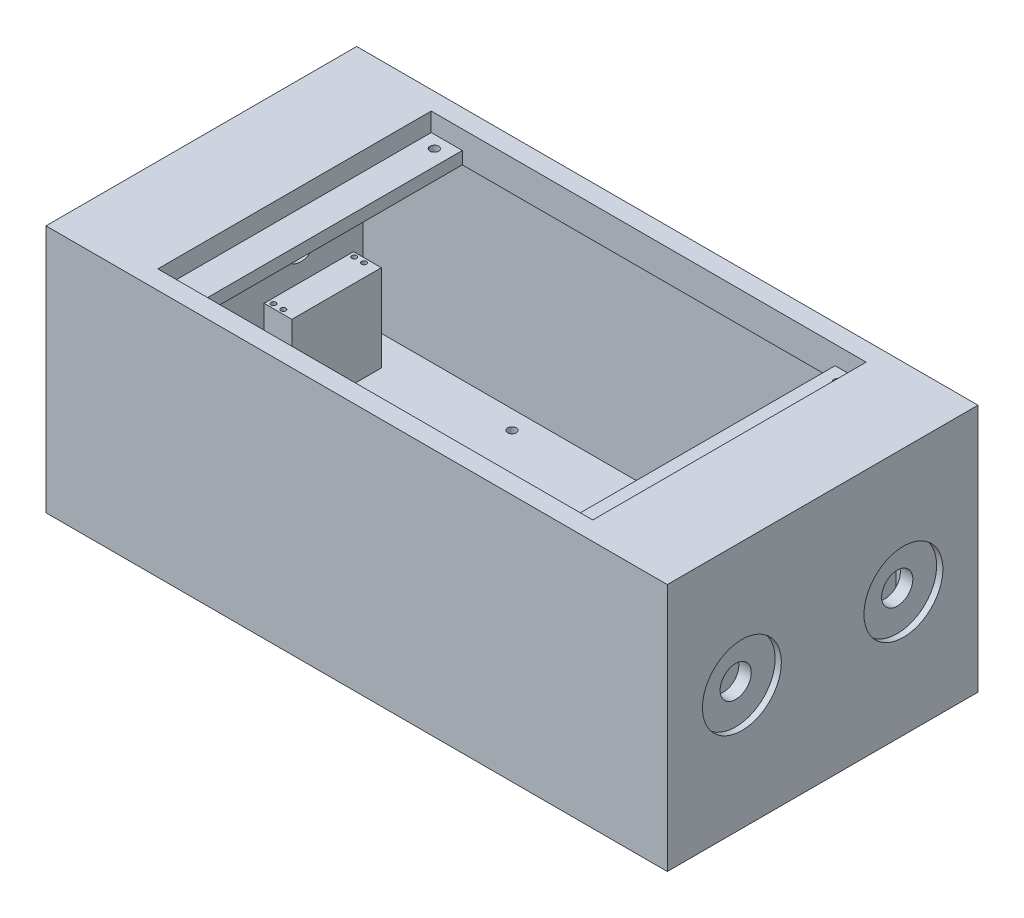
from build123d import *

# Parameters (mm, degrees)
SKETCH1_W                      = 250
SKETCH1_H                      = 200
BOSS_EXTRUDE1_DEPTH            = 250
SKETCH7_W                      = 470
SKETCH7_H                      = 230
CUT_EXTRUDE4_DEPTH             = 80
SKETCH5_R                      = 31.75
F_63_5MM_DIA_SERVO_DEPTH       = 5
MIRROR13_COPY_1_SKETCH_R       = 31.75
MIRROR13_COPY_1_DEPTH          = 5
SKETCH10_W                     = 350
SKETCH10_H                     = 220
CUT_EXTRUDE5_DEPTH             = 20
SKETCH15_W                     = 500
SKETCH15_H                     = 250
BOSS_EXTRUDE2_DEPTH            = 10
SKETCH18_W                     = 300
SKETCH18_H                     = 220
CUT_EXTRUDE11_DEPTH            = 10
SKETCH19_R                     = 3.5
CUT_EXTRUDE12_DEPTH            = 10
MIRROR15_COPY_1_SKETCH_R       = 3.5
MIRROR15_COPY_1_DEPTH          = 10
SKETCH20_R                     = 3.5
CUT_EXTRUDE13_DEPTH            = 10
MIRROR17_COPY_1_SKETCH_R       = 3.5
MIRROR17_COPY_1_DEPTH          = 10
SKETCH22_R                     = 12.55
CUT_EXTRUDE14_DEPTH            = 10
MIRROR19_COPY_1_SKETCH_R       = 12.55
MIRROR19_COPY_1_DEPTH          = 10
SKETCH23_W                     = 22.35
SKETCH23_H                     = 72
BOSS_EXTRUDE3_DEPTH            = 69.9
MIRROR21_COPY_1_SKETCH_W       = 22.35
MIRROR21_COPY_1_SKETCH_H       = 72
MIRROR21_COPY_1_DEPTH          = 69.9
F_1_0MM_DOWEL_HOLE1_AT_2_COUNT = 2
F_1_0MM_DOWEL_HOLE1_AT_2_PITCH = 8
F_1_0MM_DOWEL_HOLE1_AT_3_COUNT = 2
F_1_0MM_DOWEL_HOLE1_AT_3_PITCH = 65.49045732
F_1_0MM_DOWEL_HOLE1_AT_4_COUNT = 2
F_1_0MM_DOWEL_HOLE1_AT_4_PITCH = 65


with BuildPart() as part:
    # Sketch1 → Boss-Extrude1 (new, symmetric)
    with BuildSketch(Plane(origin=(0, 0, 0), x_dir=(0, 0, -1), z_dir=(1, 0, 0))):
        Rectangle(SKETCH1_W, SKETCH1_H)
    extrude(amount=BOSS_EXTRUDE1_DEPTH, both=True)

    # Sketch7 → Cut-Extrude4 (cut, symmetric)
    with BuildSketch(Plane(origin=(0, 0, 0), x_dir=(1, 0, 0), z_dir=(0, 1, 0))):
        Rectangle(SKETCH7_W, SKETCH7_H)
    extrude(amount=CUT_EXTRUDE4_DEPTH, both=True, mode=Mode.SUBTRACT)

    # Sketch5 → 63.5mm_dia_servo (cut)
    with BuildSketch(Plane(origin=(250, 0, 0), x_dir=(0, 0, -1), z_dir=(1, 0, 0))):
        with Locations((-65, 0)):
            Circle(SKETCH5_R)
    f_63_5mm_dia_servo = extrude(amount=-F_63_5MM_DIA_SERVO_DEPTH, mode=Mode.SUBTRACT)

    # Mirror12: 63.5mm_dia_servo across plane
    add(f_63_5mm_dia_servo.mirror(Plane.XY), mode=Mode.SUBTRACT)

    # Mirror13: 63.5mm_dia_servo across plane
    add(f_63_5mm_dia_servo.mirror(Plane(origin=(0, 0, 0), x_dir=(0, 0, 1), z_dir=(1, 0, 0))), mode=Mode.SUBTRACT)

    # Mirror13 copy 1 sketch → Mirror13 copy 1 (cut)
    with BuildSketch(Plane.ZY.offset(250)):
        with Locations((-65, 0)):
            Circle(MIRROR13_COPY_1_SKETCH_R)
    extrude(amount=-MIRROR13_COPY_1_DEPTH, mode=Mode.SUBTRACT)

    # Sketch10 → Cut-Extrude5 (cut)
    with BuildSketch(Plane(origin=(0, 100, 0), x_dir=(1, 0, 0), z_dir=(0, 1, 0))):
        Rectangle(SKETCH10_W, SKETCH10_H)
    extrude(amount=-CUT_EXTRUDE5_DEPTH, mode=Mode.SUBTRACT)

    # Sketch15 → Boss-Extrude2 (add)
    with BuildSketch(Plane(origin=(0, 75, 0), x_dir=(1, 0, 0), z_dir=(0, 1, 0))):
        Rectangle(SKETCH15_W, SKETCH15_H)
    extrude(amount=BOSS_EXTRUDE2_DEPTH)

    # Sketch18 → Cut-Extrude11 (cut)
    with BuildSketch(Plane(origin=(0, 85, 0), x_dir=(1, 0, 0), z_dir=(0, 1, 0))):
        Rectangle(SKETCH18_W, SKETCH18_H)
    extrude(amount=-CUT_EXTRUDE11_DEPTH, mode=Mode.SUBTRACT)

    # Sketch19 → Cut-Extrude12 (cut)
    with BuildSketch(Plane(origin=(0, 85, 0), x_dir=(1, 0, 0), z_dir=(0, 1, 0))):
        with Locations(Location((-162.5, 100, 0), (0, 0, 270))):
            Circle(SKETCH19_R)
    cut_extrude12 = extrude(amount=-CUT_EXTRUDE12_DEPTH, mode=Mode.SUBTRACT)

    # Mirror14: Cut-Extrude12 across plane
    add(cut_extrude12.mirror(Plane.XY), mode=Mode.SUBTRACT)

    # Mirror15: Cut-Extrude12 across plane
    add(cut_extrude12.mirror(Plane(origin=(0, 0, 0), x_dir=(0, 0, 1), z_dir=(1, 0, 0))), mode=Mode.SUBTRACT)

    # Mirror15 copy 1 sketch → Mirror15 copy 1 (cut)
    with BuildSketch(Plane(origin=(0, 85, 0), x_dir=(-1, 0, 0), z_dir=(0, 1, 0))):
        with Locations(Location((-162.5, 100, 0), (0, 0, 270))):
            Circle(MIRROR15_COPY_1_SKETCH_R)
    extrude(amount=-MIRROR15_COPY_1_DEPTH, mode=Mode.SUBTRACT)

    # Sketch20 → Cut-Extrude13 (cut)
    with BuildSketch(Plane(origin=(0, -80, 0), x_dir=(1, 0, 0), z_dir=(0, 1, 0))):
        with Locations(Location((-100, 100, 0), (0, 0, 270))):
            Circle(SKETCH20_R)
    cut_extrude13 = extrude(amount=-CUT_EXTRUDE13_DEPTH, mode=Mode.SUBTRACT)

    # Mirror16: Cut-Extrude13 across plane
    add(cut_extrude13.mirror(Plane.XY), mode=Mode.SUBTRACT)

    # Mirror17: Cut-Extrude13 across plane
    add(cut_extrude13.mirror(Plane(origin=(0, 0, 0), x_dir=(0, 0, 1), z_dir=(1, 0, 0))), mode=Mode.SUBTRACT)

    # Mirror17 copy 1 sketch → Mirror17 copy 1 (cut)
    with BuildSketch(Plane(origin=(0, -80, 0), x_dir=(-1, 0, 0), z_dir=(0, 1, 0))):
        with Locations(Location((-100, 100, 0), (0, 0, 270))):
            Circle(MIRROR17_COPY_1_SKETCH_R)
    extrude(amount=-MIRROR17_COPY_1_DEPTH, mode=Mode.SUBTRACT)

    # Sketch22 → Cut-Extrude14 (cut)
    with BuildSketch(Plane(origin=(245, 0, 0), x_dir=(0, 0, -1), z_dir=(1, 0, 0))):
        with Locations((-65, 0)):
            Circle(SKETCH22_R)
    cut_extrude14 = extrude(amount=-CUT_EXTRUDE14_DEPTH, mode=Mode.SUBTRACT)

    # Mirror18: Cut-Extrude14 across plane
    add(cut_extrude14.mirror(Plane(origin=(0, 0, 0), x_dir=(0, 0, 1), z_dir=(1, 0, 0))), mode=Mode.SUBTRACT)

    # Mirror19: Cut-Extrude14 across plane
    add(cut_extrude14.mirror(Plane.XY), mode=Mode.SUBTRACT)

    # Mirror19 copy 1 sketch → Mirror19 copy 1 (cut)
    with BuildSketch(Plane.ZY.offset(245)):
        with Locations((-65, 0)):
            Circle(MIRROR19_COPY_1_SKETCH_R)
    extrude(amount=-MIRROR19_COPY_1_DEPTH, mode=Mode.SUBTRACT)

    # Sketch23 → Boss-Extrude3 (add)
    with BuildSketch(Plane(origin=(0, -80, 0), x_dir=(1, 0, 0), z_dir=(0, 1, 0))):
        with Locations((207.175, 54.85)):
            Rectangle(SKETCH23_W, SKETCH23_H)
    boss_extrude3 = extrude(amount=BOSS_EXTRUDE3_DEPTH)

    # Mirror20: Boss-Extrude3 across plane
    add(boss_extrude3.mirror(Plane(origin=(0, 0, 0), x_dir=(0, 0, 1), z_dir=(1, 0, 0))))

    # Mirror21: Boss-Extrude3 across plane
    add(boss_extrude3.mirror(Plane.XY))

    # Mirror21 copy 1 sketch → Mirror21 copy 1 (add)
    with BuildSketch(Plane(origin=(0, -80, 0), x_dir=(-1, 0, 0), z_dir=(0, 1, 0))):
        with Locations((207.175, 54.85)):
            Rectangle(MIRROR21_COPY_1_SKETCH_W, MIRROR21_COPY_1_SKETCH_H)
    extrude(amount=MIRROR21_COPY_1_DEPTH)

    # Sketch29 → Ø1.0mm Dowel Hole1 (revolve, cut)
    with BuildSketch(Plane(origin=(-214.35, -10.1, -87.35), x_dir=(0, 0, 1), z_dir=(1, 0, 0))):
        Polygon((0, 0), (0, 9.201721238), (2, 8), (2, 0), align=None)
    f_1_0mm_dowel_hole1 = revolve(axis=Axis((-214.35, -3.75, -87.35), (0, -1, 0)), mode=Mode.SUBTRACT)

    # Ø1.0mm Dowel Hole1 at 2: Ø1.0mm Dowel Hole1 ×2
    with Locations(*[(i * F_1_0MM_DOWEL_HOLE1_AT_2_PITCH, 0, 0) for i in range(1, F_1_0MM_DOWEL_HOLE1_AT_2_COUNT)]):
        add(f_1_0mm_dowel_hole1, mode=Mode.SUBTRACT)

    # Ø1.0mm Dowel Hole1 at 3: Ø1.0mm Dowel Hole1 ×2
    with Locations(*[Vector(0.12215520134321664, 0, 0.9925110109136313) * (i * F_1_0MM_DOWEL_HOLE1_AT_3_PITCH) for i in range(1, F_1_0MM_DOWEL_HOLE1_AT_3_COUNT)]):
        add(f_1_0mm_dowel_hole1, mode=Mode.SUBTRACT)

    # Ø1.0mm Dowel Hole1 at 4: Ø1.0mm Dowel Hole1 ×2
    with Locations(*[(0, 0, i * F_1_0MM_DOWEL_HOLE1_AT_4_PITCH) for i in range(1, F_1_0MM_DOWEL_HOLE1_AT_4_COUNT)]):
        add(f_1_0mm_dowel_hole1, mode=Mode.SUBTRACT)

    # Mirror22: Ø1.0mm Dowel Hole1 across plane
    add(f_1_0mm_dowel_hole1.mirror(Plane.XY), mode=Mode.SUBTRACT)

    # Mirror22 copy 1 sketch → Mirror22 copy 1 (revolve, cut)
    with BuildSketch(Plane(origin=(-206.35, -10.1, 87.35), x_dir=(0, 0, -1), z_dir=(1, 0, 0))):
        Polygon((0, 0), (0, -9.201721238), (2, -8), (2, 0), align=None)
    revolve(axis=Axis((-206.35, -3.75, 87.35), (0, 1, 0)), mode=Mode.SUBTRACT)

    # Mirror22 copy 2 sketch → Mirror22 copy 2 (revolve, cut)
    with BuildSketch(Plane(origin=(-206.35, -10.1, 22.35), x_dir=(0, 0, -1), z_dir=(1, 0, 0))):
        Polygon((0, 0), (0, -9.201721238), (2, -8), (2, 0), align=None)
    revolve(axis=Axis((-206.35, -3.75, 22.35), (0, 1, 0)), mode=Mode.SUBTRACT)

    # Mirror22 copy 3 sketch → Mirror22 copy 3 (revolve, cut)
    with BuildSketch(Plane(origin=(-214.35, -10.1, 22.35), x_dir=(0, 0, -1), z_dir=(1, 0, 0))):
        Polygon((0, 0), (0, -9.201721238), (2, -8), (2, 0), align=None)
    revolve(axis=Axis((-214.35, -3.75, 22.35), (0, 1, 0)), mode=Mode.SUBTRACT)

    # Mirror23: Ø1.0mm Dowel Hole1 across plane
    add(f_1_0mm_dowel_hole1.mirror(Plane(origin=(0, 0, 0), x_dir=(0, 0, 1), z_dir=(1, 0, 0))), mode=Mode.SUBTRACT)

    # Mirror23 copy 1 sketch → Mirror23 copy 1 (revolve, cut)
    with BuildSketch(Plane(origin=(206.35, -10.1, -87.35), x_dir=(0, 0, 1), z_dir=(-1, 0, 0))):
        Polygon((0, 0), (0, -9.201721238), (2, -8), (2, 0), align=None)
    revolve(axis=Axis((206.35, -3.75, -87.35), (0, 1, 0)), mode=Mode.SUBTRACT)

    # Mirror23 copy 2 sketch → Mirror23 copy 2 (revolve, cut)
    with BuildSketch(Plane(origin=(206.35, -10.1, -22.35), x_dir=(0, 0, 1), z_dir=(-1, 0, 0))):
        Polygon((0, 0), (0, -9.201721238), (2, -8), (2, 0), align=None)
    revolve(axis=Axis((206.35, -3.75, -22.35), (0, 1, 0)), mode=Mode.SUBTRACT)

    # Mirror23 copy 3 sketch → Mirror23 copy 3 (revolve, cut)
    with BuildSketch(Plane(origin=(214.35, -10.1, -22.35), x_dir=(0, 0, 1), z_dir=(-1, 0, 0))):
        Polygon((0, 0), (0, -9.201721238), (2, -8), (2, 0), align=None)
    revolve(axis=Axis((214.35, -3.75, -22.35), (0, 1, 0)), mode=Mode.SUBTRACT)

    # Mirror23 copy 4 sketch → Mirror23 copy 4 (revolve, cut)
    with BuildSketch(Plane(origin=(214.35, -10.1, 87.35), x_dir=(0, 0, -1), z_dir=(-1, 0, 0))):
        Polygon((0, 0), (0, 9.201721238), (2, 8), (2, 0), align=None)
    revolve(axis=Axis((214.35, -3.75, 87.35), (0, -1, 0)), mode=Mode.SUBTRACT)

    # Mirror23 copy 5 sketch → Mirror23 copy 5 (revolve, cut)
    with BuildSketch(Plane(origin=(206.35, -10.1, 87.35), x_dir=(0, 0, -1), z_dir=(-1, 0, 0))):
        Polygon((0, 0), (0, 9.201721238), (2, 8), (2, 0), align=None)
    revolve(axis=Axis((206.35, -3.75, 87.35), (0, -1, 0)), mode=Mode.SUBTRACT)

    # Mirror23 copy 6 sketch → Mirror23 copy 6 (revolve, cut)
    with BuildSketch(Plane(origin=(206.35, -10.1, 22.35), x_dir=(0, 0, -1), z_dir=(-1, 0, 0))):
        Polygon((0, 0), (0, 9.201721238), (2, 8), (2, 0), align=None)
    revolve(axis=Axis((206.35, -3.75, 22.35), (0, -1, 0)), mode=Mode.SUBTRACT)

    # Mirror23 copy 7 sketch → Mirror23 copy 7 (revolve, cut)
    with BuildSketch(Plane(origin=(214.35, -10.1, 22.35), x_dir=(0, 0, -1), z_dir=(-1, 0, 0))):
        Polygon((0, 0), (0, 9.201721238), (2, 8), (2, 0), align=None)
    revolve(axis=Axis((214.35, -3.75, 22.35), (0, -1, 0)), mode=Mode.SUBTRACT)


solid = part.part
